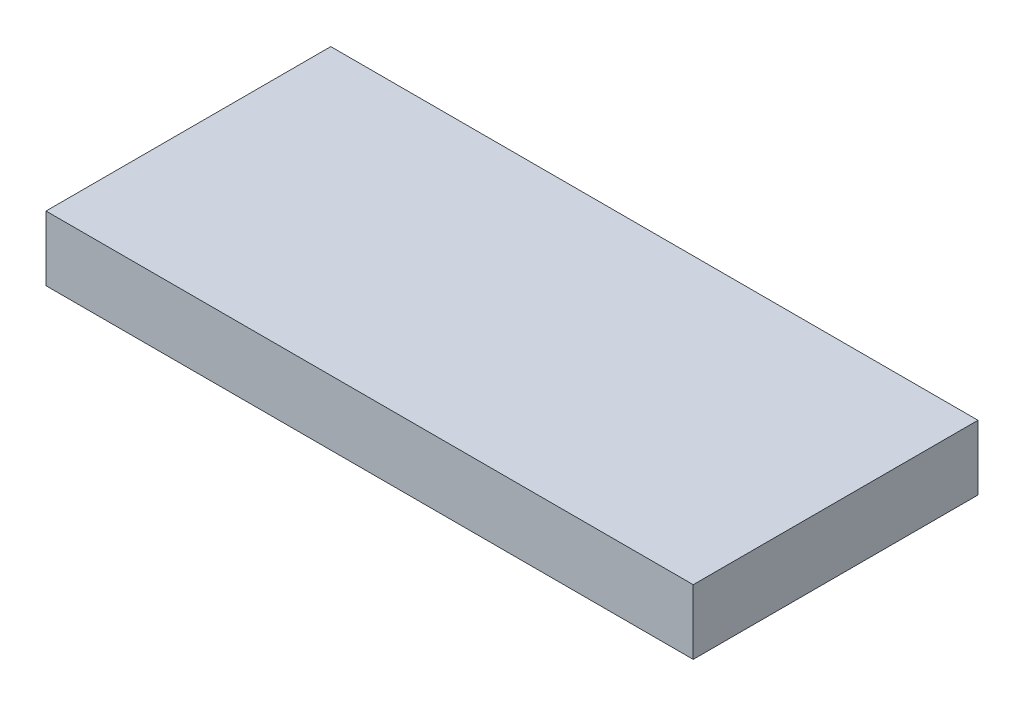
from build123d import *

# Parameters (mm, degrees)
SKETCH1_W           = 50
SKETCH1_H           = 22
BOSS_EXTRUDE1_DEPTH = 5


with BuildPart() as part:
    # Sketch1 → Boss-Extrude1 (new body)
    with BuildSketch(Plane(origin=(0, 0, 0), x_dir=(1, 0, 0), z_dir=(0, 1, 0))):
        with Locations((25, 11)):
            Rectangle(SKETCH1_W, SKETCH1_H)
    extrude(amount=BOSS_EXTRUDE1_DEPTH)


solid = part.part
